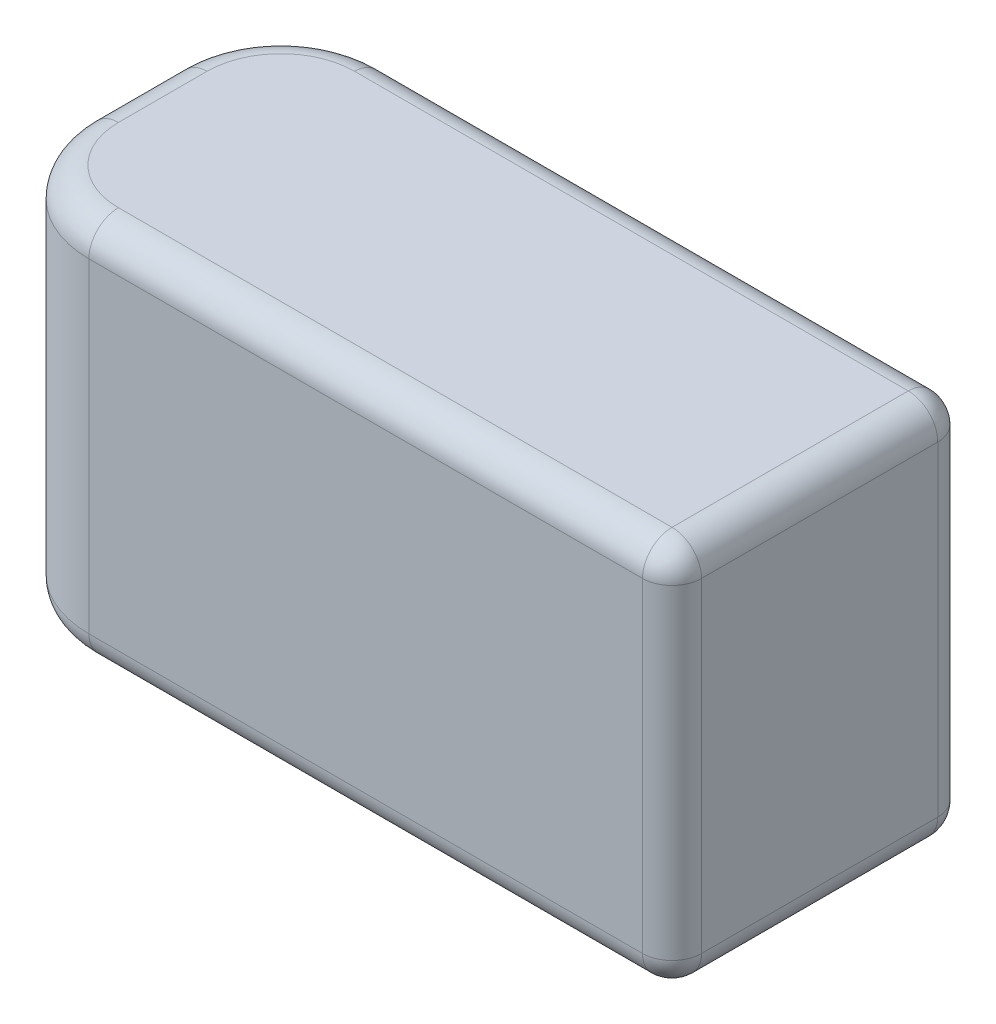
from build123d import *

# Parameters (mm, degrees)
SKETCH1_W           = 46.5
SKETCH1_H           = 26
BOSS_EXTRUDE1_DEPTH = 20
FILLET1_R           = 7
FILLET2_R           = 2


with BuildPart() as part:
    # Sketch1 → Boss-Extrude1 (new body)
    with BuildSketch(Plane.XY):
        Rectangle(SKETCH1_W, SKETCH1_H)
    extrude(amount=BOSS_EXTRUDE1_DEPTH)

    # Fillet1
    fillet1_edges = [part.edges().sort_by_distance(p)[0] for p in [
        (-23.25, 0, 20),
        (-23.25, 0, 0),
    ]]
    fillet(fillet1_edges, radius=FILLET1_R)

    # Fillet2
    fillet2_edges = [part.edges().sort_by_distance(p)[0] for p in [
        (-23.25, -13, 10),
        (-23.25, 13, 10),
        (3.5, -13, 0),
        (3.5, -13, 20),
        (-21.199747468, -13, 17.949747468),
        (-21.199747468, -13, 2.050252532),
        (-21.199747468, 13, 17.949747468),
        (-21.199747468, 13, 2.050252532),
        (23.25, 0, 20),
        (3.5, 13, 0),
        (23.25, 0, 0),
        (23.25, -13, 10),
        (23.25, 13, 10),
        (3.5, 13, 20),
    ]]
    fillet(fillet2_edges, radius=FILLET2_R)


solid = part.part
